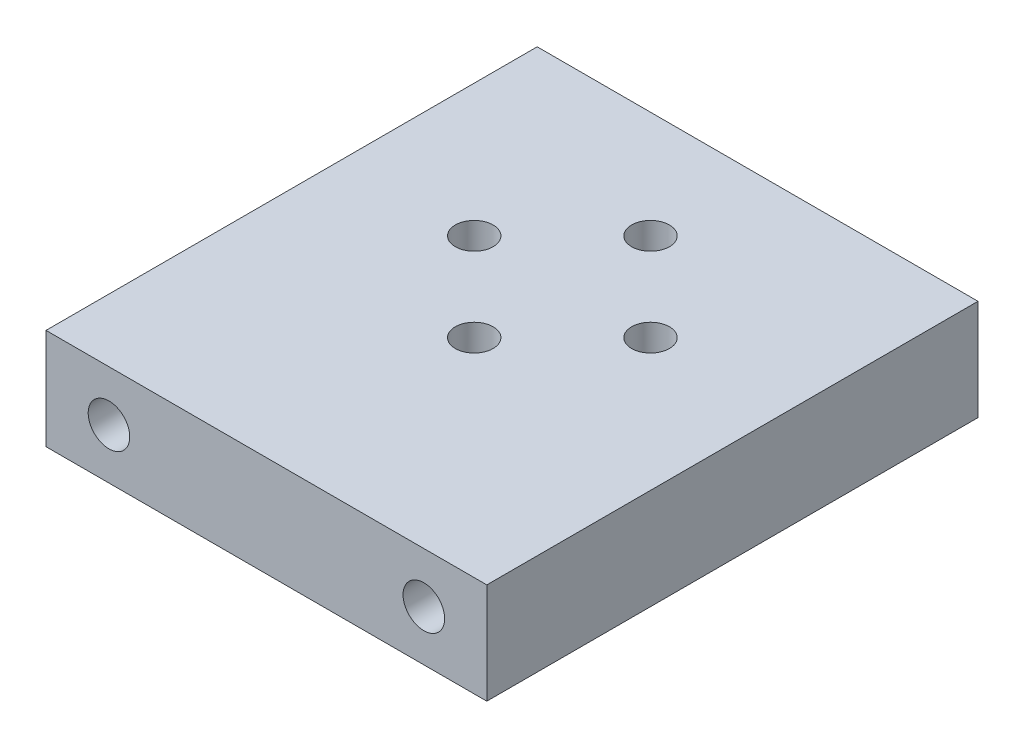
from build123d import *

# Parameters (mm, degrees)
SKETCH_1_W          = 35
SKETCH_1_H          = 39
EXTRUDE_1_DEPTH     = 8
SKETCH_2_R          = 1.65
CUT_EXTRUDE_1_DEPTH = 12
SKETCH_5_R          = 5.5
CUT_EXTRUDE_3_DEPTH = 5
CUT_EXTRUDE_5_DEPTH = 5
SKETCH_8_R          = 1.5
CUT_EXTRUDE_6_DEPTH = 5
CUT_EXTRUDE_START   = -12
SKETCH_9_R          = 1.65
CUT_EXTRUDE_7_DEPTH = 12


with BuildPart() as part:
    # 草图1 → 凸台-拉伸1 (new body)
    with BuildSketch(Plane(origin=(0, 0, 0), x_dir=(1, 0, 0), z_dir=(0, 1, 0))):
        Rectangle(SKETCH_1_W, SKETCH_1_H)
    extrude(amount=EXTRUDE_1_DEPTH)

    # 草图2 → 切除-拉伸1 (cut)
    with BuildSketch(Plane(origin=(0, 0, -19.5), x_dir=(-1, 0, 0), z_dir=(0, 0, -1))):
        with Locations((12.5, 4)):
            Circle(SKETCH_2_R)
        with Locations(Location((-12.5, 4, 0), (0, 0, 180))):
            Circle(SKETCH_2_R)
    extrude(amount=-CUT_EXTRUDE_1_DEPTH, mode=Mode.SUBTRACT)

    # 草图5 → 切除-拉伸3 (cut)
    with BuildSketch(Plane(origin=(0, 0, 0), x_dir=(1, 0, 0), z_dir=(0, 1, 0))):
        with Locations(Location((0, 4, 0), (0, 0, 270))):
            Circle(SKETCH_5_R)
    extrude(amount=CUT_EXTRUDE_3_DEPTH, mode=Mode.SUBTRACT)

    # 草图7 → 切除-拉伸5 (cut)
    with BuildSketch(Plane.XZ):
        with BuildLine():
            Line((1.5, -11), (1.5, -9))
            Line((1.5, -9), (-1.5, -9))
            Line((-1.5, -9), (-1.5, -11))
            ThreePointArc((-1.5, -11), (0, -12.5), (1.5, -11))
        make_face()
        with BuildLine():
            Line((-7, -5.5), (-5, -5.5))
            Line((-5, -5.5), (-5, -2.5))
            Line((-5, -2.5), (-7, -2.5))
            ThreePointArc((-7, -2.5), (-8.5, -4), (-7, -5.5))
        make_face()
        with BuildLine():
            Line((-1.5, 3), (-1.5, 1))
            Line((-1.5, 1), (1.5, 1))
            Line((1.5, 1), (1.5, 3))
            ThreePointArc((1.5, 3), (0, 4.5), (-1.5, 3))
        make_face()
        with BuildLine():
            Line((7, -2.5), (5, -2.5))
            Line((5, -2.5), (5, -5.5))
            Line((5, -5.5), (7, -5.5))
            ThreePointArc((7, -5.5), (8.5, -4), (7, -2.5))
        make_face()
    extrude(amount=-CUT_EXTRUDE_5_DEPTH, mode=Mode.SUBTRACT)

    # 草图8 → 切除-拉伸6 (cut)
    with BuildSketch(Plane.XZ.offset(-5)):
        with Locations(Location((0, -11, 0), (0, 0, 180))):
            Circle(SKETCH_8_R)
        with Locations(Location((7, -4, 0), (0, 0, 90))):
            Circle(SKETCH_8_R)
        with Locations((0, 3)):
            Circle(SKETCH_8_R)
        with Locations(Location((-7, -4, 0), (0, 0, 90))):
            Circle(SKETCH_8_R)
    extrude(amount=-CUT_EXTRUDE_6_DEPTH, mode=Mode.SUBTRACT)

    # 草图9 → 切除-拉伸7 (cut)
    with BuildSketch(Plane.XY.offset(19.5).offset(CUT_EXTRUDE_START)):
        with Locations(Location((-12.5, 4, 0), (0, 0, 180))):
            Circle(SKETCH_9_R)
        with Locations((12.5, 4)):
            Circle(SKETCH_9_R)
    extrude(amount=CUT_EXTRUDE_7_DEPTH, mode=Mode.SUBTRACT)


solid = part.part
